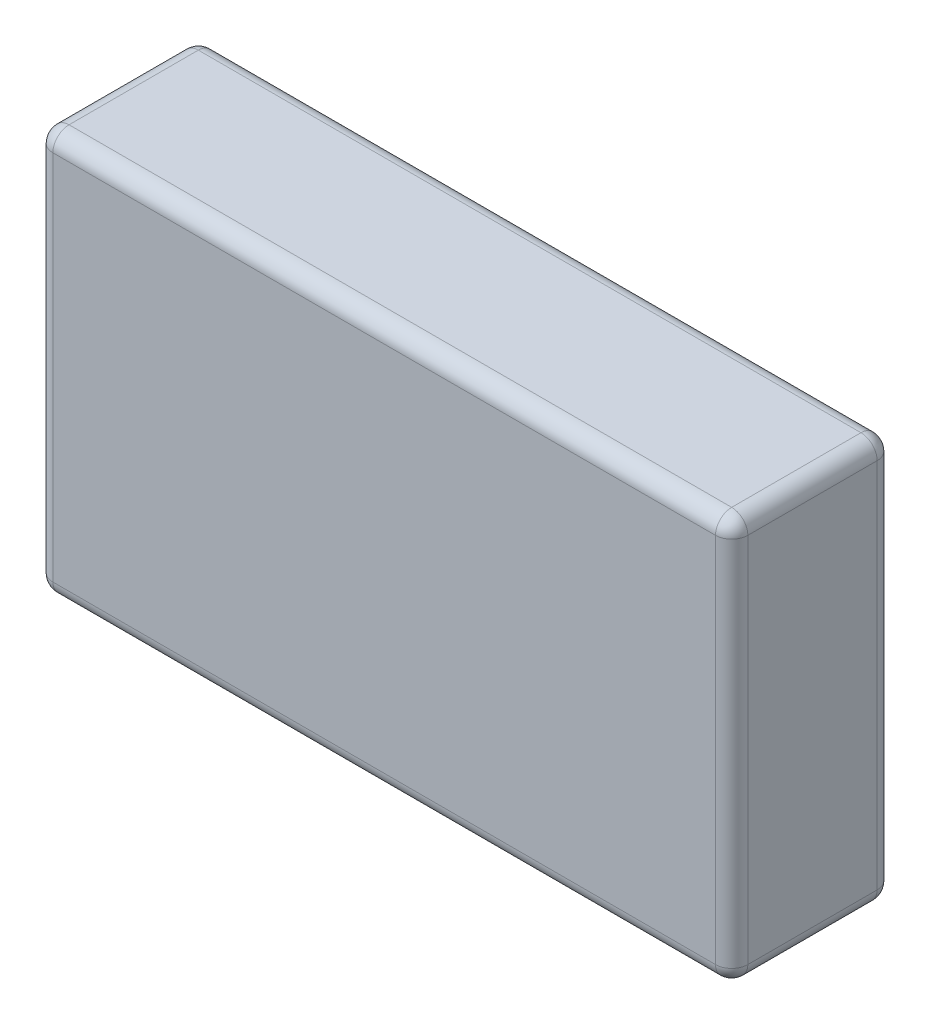
from build123d import *

# Parameters (mm, degrees)
SKETCH_1_W      = 43
SKETCH_1_H      = 25
EXTRUDE_1_DEPTH = 10
FILLET_1_R      = 1


with BuildPart() as part:
    # ｽｹｯﾁ1 → ﾎﾞｽ - 押し出し1 (new body)
    with BuildSketch(Plane.XY):
        Rectangle(SKETCH_1_W, SKETCH_1_H)
    extrude(amount=EXTRUDE_1_DEPTH)

    # ﾌｨﾚｯﾄ1
    fillet_1_edges = [part.edges().sort_by_distance(p)[0] for p in [
        (-21.5, 0, 10),
        (0, -12.5, 10),
        (21.5, 0, 10),
        (0, -12.5, 0),
        (-21.5, 0, 0),
        (0, 12.5, 0),
        (21.5, 0, 0),
        (0, 12.5, 10),
        (21.5, -12.5, 5),
        (-21.5, -12.5, 5),
        (-21.5, 12.5, 5),
        (21.5, 12.5, 5),
    ]]
    fillet(fillet_1_edges, radius=FILLET_1_R)


solid = part.part
